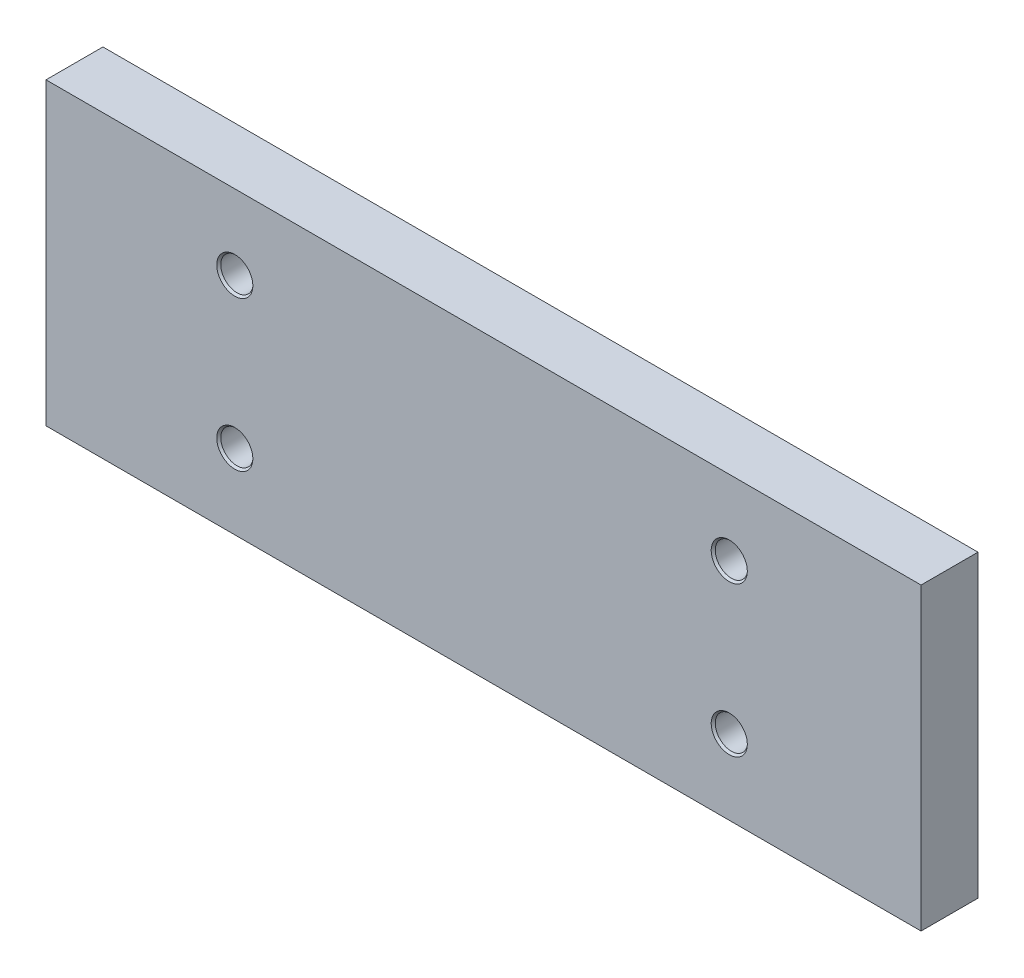
from build123d import *

# Parameters (mm, degrees)
SCHIZZO1_W                            = 292
SCHIZZO1_H                            = 100
ESTRUSIONE_ESTRUSIONE1_DEPTH          = 19
FORO_FILETTATO_M12X1_25_1_D           = 10.8
FORO_FILETTATO_M12X1_25_1_CSINK_D     = 12.05
FORO_FILETTATO_M12X1_25_1_CSINK_ANGLE = 82


with BuildPart() as part:
    # Schizzo1 → Estrusione-Estrusione1 (new body)
    with BuildSketch(Plane.XY):
        with Locations((31.207100592, -4.733727811)):
            Rectangle(SCHIZZO1_W, SCHIZZO1_H)
    extrude(amount=ESTRUSIONE_ESTRUSIONE1_DEPTH)

    # Foro filettato M12x1.25-1 (through all)
    with Locations(Plane(origin=(-51.792899408, 20.266272189, 19), x_dir=(1, 0, 0), z_dir=(0, 0, 1))):
        with Locations((0, 0), (0, -50), (165, -50), (165, 0)):
            CounterSinkHole(FORO_FILETTATO_M12X1_25_1_D / 2, FORO_FILETTATO_M12X1_25_1_CSINK_D / 2, counter_sink_angle=FORO_FILETTATO_M12X1_25_1_CSINK_ANGLE)


solid = part.part
